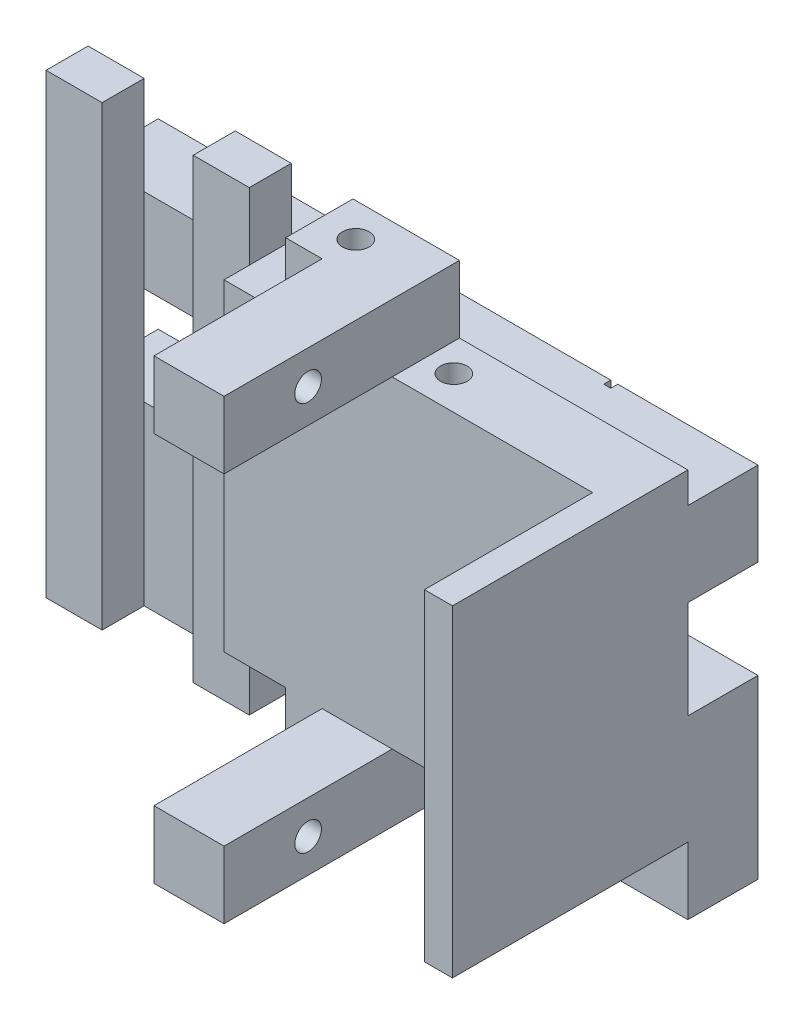
from build123d import *

# Parameters (mm, degrees)
EXTRUDE_1_DEPTH     = 4.8
SKETCH_2_W          = 5
SKETCH_2_H          = 4.8
SKETCH_2_W_2        = 2
SKETCH_2_H_2        = 23
EXTRUDE_2_DEPTH     = 12
SKETCH_3_R          = 0.95
CUT_EXTRUDE_1_DEPTH = 5
SKETCH_6_R          = 0.95
CUT_EXTRUDE_4_DEPTH = 32
SKETCH_7_W          = 42.8
SKETCH_7_H          = 6
EXTRUDE_3_DEPTH     = 5
SKETCH_8_W          = 4
SKETCH_8_H          = 32.6
EXTRUDE_4_DEPTH     = 3
SKETCH_9_W          = 42.8
SKETCH_9_H          = 12.6
EXTRUDE_6_DEPTH     = 5
SKETCH_11_R         = 0.95
CUT_EXTRUDE_5_DEPTH = 47.323752007
SKETCH_12_W         = 0.5
SKETCH_12_H         = 25.6
CUT_EXTRUDE_6_DEPTH = 0.5


with BuildPart() as part:
    # 草图1 → 凸台-拉伸1 (new body)
    with BuildSketch(Plane.XY):
        Polygon((12, 0), (28.3, 0), (28.3, -23), (12, -23), (12, -27.8), (4.4, -27.8), (4.4, -23), (0, -23), (0, 0), (4.4, 0), (4.4, 4.8), (12, 4.8), align=None)
    extrude(amount=EXTRUDE_1_DEPTH)

    # 草图2 → 凸台-拉伸2 (add)
    with BuildSketch(Plane.XY.offset(4.8)):
        with Locations((9.5, 2.4)):
            Rectangle(SKETCH_2_W, SKETCH_2_H)
        with Locations((9.5, -25.4)):
            Rectangle(SKETCH_2_W, SKETCH_2_H)
        with Locations((27.3, -11.5)):
            Rectangle(SKETCH_2_W_2, SKETCH_2_H_2)
    extrude(amount=EXTRUDE_2_DEPTH)

    # 草图3 → 切除-拉伸1 (cut)
    with BuildSketch(Plane.ZY.offset(-7)):
        with Locations((10.8, 2.4)):
            Circle(SKETCH_3_R)
        with Locations((10.8, -25.4)):
            Circle(SKETCH_3_R)
    extrude(amount=-CUT_EXTRUDE_1_DEPTH, mode=Mode.SUBTRACT)

    # 草图6 → 切除-拉伸4 (cut)
    with BuildSketch(Plane(origin=(0, 0, 0), x_dir=(1, 0, 0), z_dir=(0, 1, 0))):
        with Locations(Location((14, -2.4, 0), (0, 0, 270))):
            Circle(SKETCH_6_R)
    extrude(amount=-CUT_EXTRUDE_4_DEPTH, mode=Mode.SUBTRACT)

    # 草图7 → 凸台-拉伸3 (add)
    with BuildSketch(Plane(origin=(0, 0, 0), x_dir=(-1, 0, 0), z_dir=(0, 0, -1))):
        with Locations((-6.9, -5.2)):
            Rectangle(SKETCH_7_W, SKETCH_7_H)
    extrude(amount=EXTRUDE_3_DEPTH)

    # 草图8 → 凸台-拉伸4 (add)
    with BuildSketch(Plane.XY):
        with Locations((-2, -11.5)):
            Rectangle(SKETCH_8_W, SKETCH_8_H)
        with Locations((-12.5, -11.5)):
            Rectangle(SKETCH_8_W, SKETCH_8_H)
    extrude(amount=EXTRUDE_4_DEPTH)

    # 草图9 → 凸台-拉伸6 (add)
    with BuildSketch(Plane(origin=(0, 0, 0), x_dir=(-1, 0, 0), z_dir=(0, 0, -1))):
        with Locations((-6.9, -21.5)):
            Rectangle(SKETCH_9_W, SKETCH_9_H)
    extrude(amount=EXTRUDE_6_DEPTH)

    # 草图11 → 切除-拉伸5 (cut, through all)
    with BuildSketch(Plane(origin=(0, 4.8, 0), x_dir=(1, 0, 0), z_dir=(0, 1, 0))):
        with Locations(Location((7, -2.4, 0), (0, 0, 180))):
            Circle(SKETCH_11_R)
    extrude(amount=-CUT_EXTRUDE_5_DEPTH, mode=Mode.SUBTRACT)

    # 草图12 → 切除-拉伸6 (cut)
    with BuildSketch(Plane(origin=(0, 0, -5), x_dir=(-1, 0, 0), z_dir=(0, 0, -1))):
        with Locations((-18.05, -15)):
            Rectangle(SKETCH_12_W, SKETCH_12_H)
        with Locations((-0.75, -15)):
            Rectangle(SKETCH_12_W, SKETCH_12_H)
    extrude(amount=-CUT_EXTRUDE_6_DEPTH, mode=Mode.SUBTRACT)


solid = part.part
